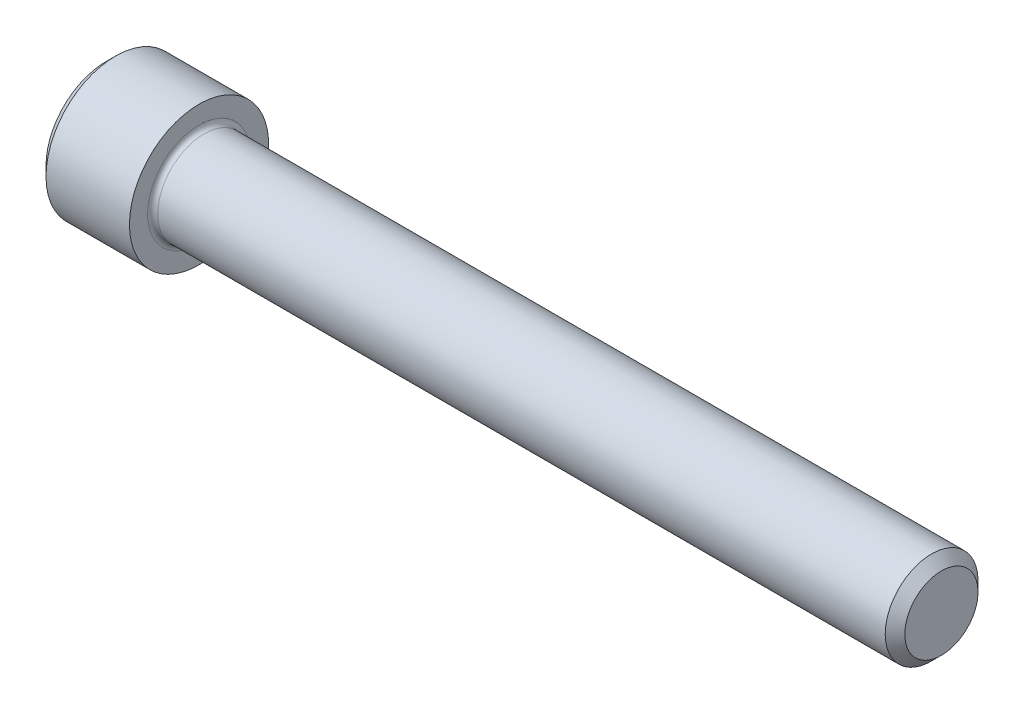
from build123d import *

# Parameters (mm, degrees)
FILLET1_R   = 0.4318
HEX_2_DEPTH = 3.8354


with BuildPart() as part:
    # BodySke → Base-Revolve (revolve)
    with BuildSketch(Plane.XY, mode=Mode.PRIVATE) as base_revolve_sk:
        Polygon((0, 0), (0, 5.15366), (0.8001, 5.95376), (7.9375, 5.95376), (7.9375, 3.96875), (70.59803, 3.96875), (71.4375, 3.12928), (71.4375, 0), align=None)
    revolve(base_revolve_sk.sketch.rotate(Axis((-31.75, 0, 0), (1, 0, 0)), 90), axis=Axis((-31.75, 0, 0), (1, 0, 0)))

    # Fillet1
    fillet1_edges = [part.edges().sort_by_distance(p)[0] for p in [
        (7.9375, 0, -3.96875),
    ]]
    fillet(fillet1_edges, radius=FILLET1_R)

    # Sketch2 → Hex-PreBroach (revolve, cut)
    with BuildSketch(Plane.XY, mode=Mode.PRIVATE) as hex_prebroach_sk:
        Polygon((0, 3.175), (3.8354, 3.175), (5.668487105, 0), (0, 0), align=None)
    revolve(hex_prebroach_sk.sketch.rotate(Axis((0, 0, 0), (1, 0, 0)), 90), axis=Axis((0, 0, 0), (1, 0, 0)), mode=Mode.SUBTRACT)

    # Sketch3 → Hex 2 (cut)
    with BuildSketch(Plane(origin=(0, 0, 0), x_dir=(0, 0.500000000000001, 0.866025403784438), z_dir=(-1, 0, 0))):
        Polygon((1.833087105, 3.175), (-1.833087105, 3.175), (-3.666174209, 0), (-1.833087105, -3.175), (1.833087105, -3.175), (3.666174209, 0), align=None)
    extrude(amount=-HEX_2_DEPTH, mode=Mode.SUBTRACT)


solid = part.part
